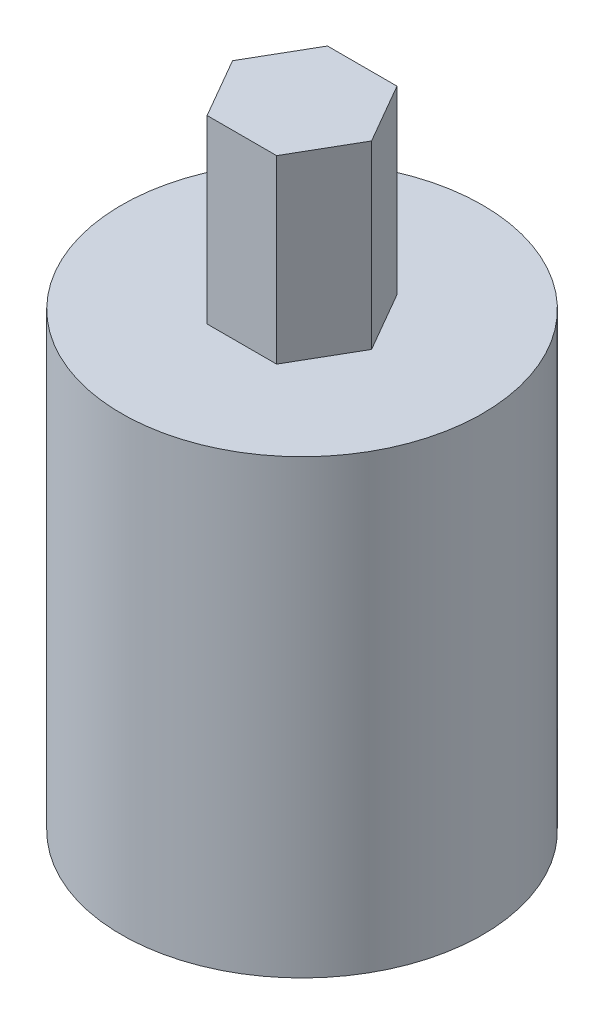
from build123d import *

# Parameters (mm, degrees)
EXTRUDE_1_DEPTH     = 3
SKETCH_2_R          = 3
EXTRUDE_2_DEPTH     = 7.5
CUT_EXTRUDE_START   = 7.5
CUT_EXTRUDE_1_DEPTH = 6.5


with BuildPart() as part:
    # 草图1 → 凸台-拉伸1 (new body)
    with BuildSketch(Plane(origin=(0, 0, 0), x_dir=(1, 0, 0), z_dir=(0, 1, 0))):
        Polygon((0.577350269, 1), (-0.577350269, 1), (-1.154700538, 0), (-0.577350269, -1), (0.577350269, -1), (1.154700538, 0), align=None)
    extrude(amount=EXTRUDE_1_DEPTH)


with BuildPart() as body_2:
    # 草图2 → 凸台-拉伸2 (new body)
    with BuildSketch(Plane.XZ):
        with Locations(Location((0, 0, 0), (0, 0, 270))):
            Circle(SKETCH_2_R)
    extrude(amount=EXTRUDE_2_DEPTH)

    # 草图2<3> → 切除-拉伸1 (cut)
    with BuildSketch(Plane.XZ.offset(CUT_EXTRUDE_START)):
        with BuildLine():
            Line((-1.130029762, -1.130029762), (-1.130029762, -2.230029762))
            ThreePointArc((-1.130029762, -2.230029762), (0, -2.5), (1.130029762, -2.230029762))
            Line((1.130029762, -2.230029762), (1.130029762, -1.130029762))
            Line((1.130029762, -1.130029762), (2.230029762, -1.130029762))
            ThreePointArc((2.230029762, -1.130029762), (2.5, 0), (2.230029762, 1.130029762))
            Line((2.230029762, 1.130029762), (1.130029762, 1.130029762))
            Line((1.130029762, 1.130029762), (1.130029762, 2.230029762))
            ThreePointArc((1.130029762, 2.230029762), (0, 2.5), (-1.130029762, 2.230029762))
            Line((-1.130029762, 2.230029762), (-1.130029762, 1.130029762))
            Line((-1.130029762, 1.130029762), (-2.230029762, 1.130029762))
            ThreePointArc((-2.230029762, 1.130029762), (-2.5, 0), (-2.230029762, -1.130029762))
            Line((-2.230029762, -1.130029762), (-1.130029762, -1.130029762))
        make_face()
    extrude(amount=-CUT_EXTRUDE_1_DEPTH, mode=Mode.SUBTRACT)


solid = Compound([part.part, body_2.part])
